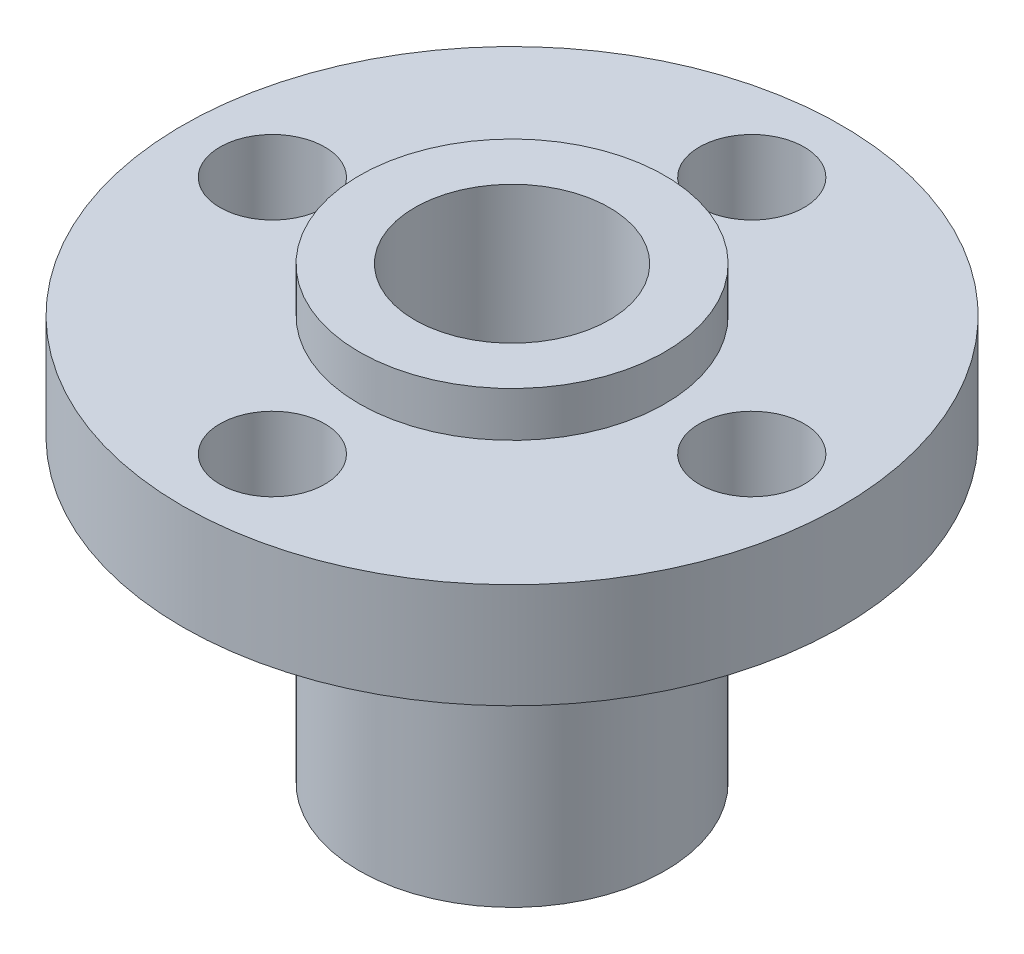
from build123d import *

# Parameters (mm, degrees)
SKETCH1_R                = 11
BOSS_EXTRUDE1_DEPTH      = 3.5
BOSS_EXTRUDE2_DEPTH      = 1.5
BOSS_EXTRUDE2_DEPTH_BACK = 13.5
SKETCH2_R                = 5.1
SKETCH3_R                = 3.25
CUT_EXTRUDE1_DEPTH       = 22.610182785
SKETCH4_R                = 1.75
CUT_EXTRUDE2_DEPTH       = 21.597329924


with BuildPart() as part:
    # Sketch1 → Boss-Extrude1 (new body)
    with BuildSketch(Plane(origin=(0, 0, 0), x_dir=(1, 0, 0), z_dir=(0, 1, 0))):
        with Locations(Location((0, 0, 0), (0, 0, 270))):
            Circle(SKETCH1_R)
    extrude(amount=BOSS_EXTRUDE1_DEPTH)

    # Sketch2 → Boss-Extrude2 (add, two sides: drawn at the far end of the back side and taken through both)
    with BuildSketch(Plane(origin=(0, 3.5, 0), x_dir=(1, 0, 0), z_dir=(0, 1, 0)).offset(-BOSS_EXTRUDE2_DEPTH_BACK)):
        with Locations(Location((0, 0, 0), (0, 0, 270))):
            Circle(SKETCH2_R)
    extrude(amount=BOSS_EXTRUDE2_DEPTH + BOSS_EXTRUDE2_DEPTH_BACK)

    # Sketch3 → Cut-Extrude1 (cut, through all)
    with BuildSketch(Plane(origin=(0, 5, 0), x_dir=(1, 0, 0), z_dir=(0, 1, 0))):
        with Locations(Location((0, 0, 0), (0, 0, 270))):
            Circle(SKETCH3_R)
    extrude(amount=-CUT_EXTRUDE1_DEPTH, mode=Mode.SUBTRACT)

    # Sketch4 → Cut-Extrude2 (cut, through all)
    with BuildSketch(Plane(origin=(0, 3.5, 0), x_dir=(1, 0, 0), z_dir=(0, 1, 0))):
        with Locations(Location((-8, 0, 0), (0, 0, 270))):
            Circle(SKETCH4_R)
        with Locations(Location((0, 8, 0), (0, 0, 270))):
            Circle(SKETCH4_R)
        with Locations(Location((8, 0, 0), (0, 0, 270))):
            Circle(SKETCH4_R)
        with Locations(Location((0, -8, 0), (0, 0, 270))):
            Circle(SKETCH4_R)
    extrude(amount=-CUT_EXTRUDE2_DEPTH, mode=Mode.SUBTRACT)


solid = part.part
